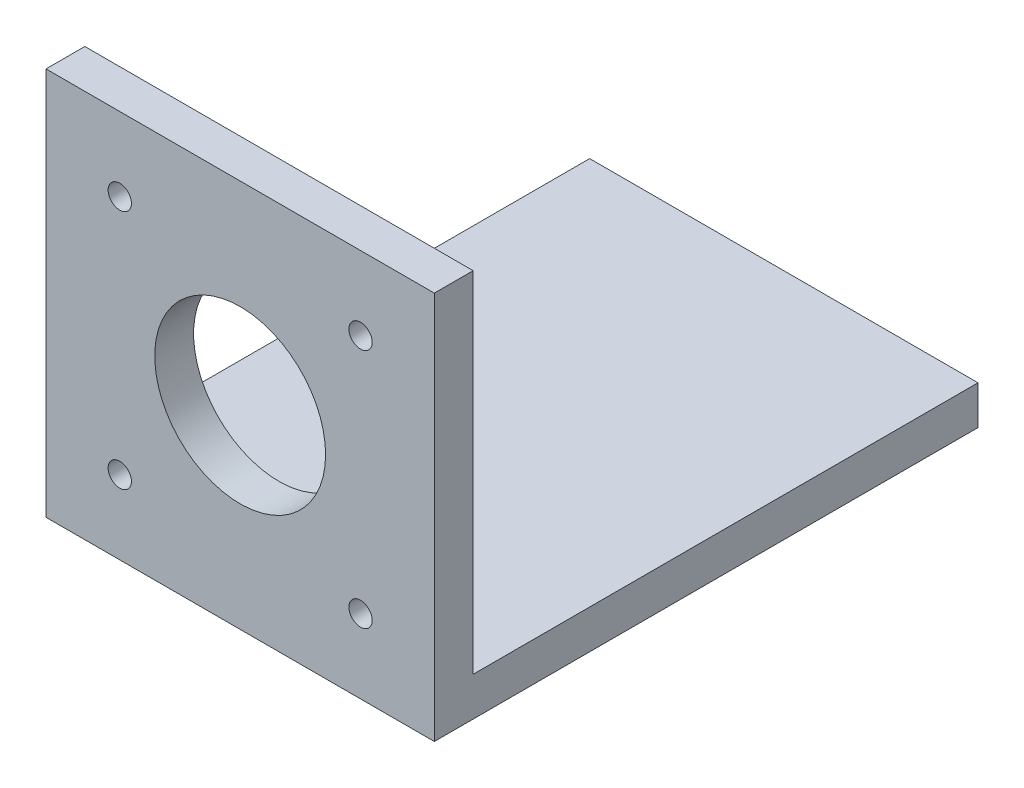
from build123d import *

# Parameters (mm, degrees)
BOSS_EXTRUDE1_DEPTH = 50
CUT_EXTRUDE1_REACH  = 101.499
SKETCH3_R           = 11
SKETCH3_R_2         = 1.5


with BuildPart() as part:
    # Sketch1 → Boss-Extrude1 (new body)
    with BuildSketch(Plane(origin=(0, 0, 0), x_dir=(0, 0, -1), z_dir=(1, 0, 0))):
        Polygon((0, 0), (0, 50), (5, 50), (5, 5), (70, 5), (70, 0), align=None)
    extrude(amount=BOSS_EXTRUDE1_DEPTH)

    # Sketch3 → Cut-Extrude1 (cut, up to next)
    with BuildSketch(Plane.XY, mode=Mode.PRIVATE) as cut_extrude1_sk1:
        with Locations((25, 25)):
            Circle(SKETCH3_R)
    cut_extrude1_tool1 = extrude(cut_extrude1_sk1.sketch, amount=-CUT_EXTRUDE1_REACH, mode=Mode.PRIVATE) & part.part
    # Sketch3 → Cut-Extrude1 (cut, up to next)
    with BuildSketch(Plane.XY, mode=Mode.PRIVATE) as cut_extrude1_sk2:
        with Locations((40.5, 40.5)):
            Circle(SKETCH3_R_2)
    cut_extrude1_tool2 = extrude(cut_extrude1_sk2.sketch, amount=-CUT_EXTRUDE1_REACH, mode=Mode.PRIVATE) & part.part
    # Sketch3 → Cut-Extrude1 (cut, up to next)
    with BuildSketch(Plane.XY, mode=Mode.PRIVATE) as cut_extrude1_sk3:
        with Locations((9.5, 40.5)):
            Circle(SKETCH3_R_2)
    cut_extrude1_tool3 = extrude(cut_extrude1_sk3.sketch, amount=-CUT_EXTRUDE1_REACH, mode=Mode.PRIVATE) & part.part
    # Sketch3 → Cut-Extrude1 (cut, up to next)
    with BuildSketch(Plane.XY, mode=Mode.PRIVATE) as cut_extrude1_sk4:
        with Locations((9.5, 9.5)):
            Circle(SKETCH3_R_2)
    cut_extrude1_tool4 = extrude(cut_extrude1_sk4.sketch, amount=-CUT_EXTRUDE1_REACH, mode=Mode.PRIVATE) & part.part
    # Sketch3 → Cut-Extrude1 (cut, up to next)
    with BuildSketch(Plane.XY, mode=Mode.PRIVATE) as cut_extrude1_sk5:
        with Locations((40.5, 9.5)):
            Circle(SKETCH3_R_2)
    cut_extrude1_tool5 = extrude(cut_extrude1_sk5.sketch, amount=-CUT_EXTRUDE1_REACH, mode=Mode.PRIVATE) & part.part
    add(cut_extrude1_tool1.solids().sort_by_distance((25, 25, 0))[0], mode=Mode.SUBTRACT)
    add(cut_extrude1_tool2.solids().sort_by_distance((40.5, 40.5, 0))[0], mode=Mode.SUBTRACT)
    add(cut_extrude1_tool3.solids().sort_by_distance((9.5, 40.5, 0))[0], mode=Mode.SUBTRACT)
    add(cut_extrude1_tool4.solids().sort_by_distance((9.5, 9.5, 0))[0], mode=Mode.SUBTRACT)
    add(cut_extrude1_tool5.solids().sort_by_distance((40.5, 9.5, 0))[0], mode=Mode.SUBTRACT)


solid = part.part
